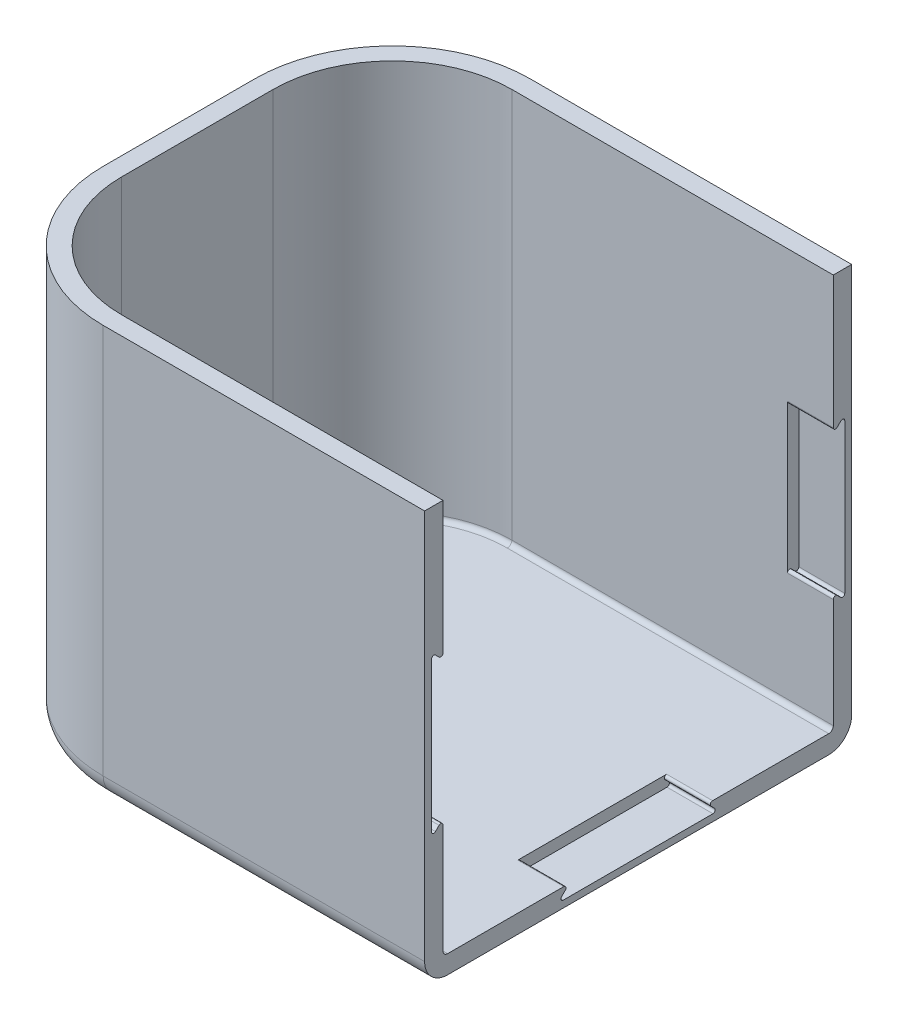
from build123d import *

# Parameters (mm, degrees)
SKETCH_1_W           = 100
SKETCH_1_H           = 93
EXTRUDE_1_DEPTH      = 90
FILLET_8_R           = 30
FILLET_9_R           = 5
SHELL_4_T            = -4
CUT_EXTRUDE_16_DEPTH = 10
FILLET_12_R          = 0.5


with BuildPart() as part:
    # 草圖1 → 填料-伸長1 (new body)
    with BuildSketch(Plane(origin=(0, 0, 0), x_dir=(1, 0, 0), z_dir=(0, 1, 0))):
        with Locations((-50, 0)):
            Rectangle(SKETCH_1_W, SKETCH_1_H)
    extrude(amount=EXTRUDE_1_DEPTH)

    # 圓角8
    fillet_8_edges = [part.edges().sort_by_distance(p)[0] for p in [
        (-100, 45, 46.5),
        (-100, 45, -46.5),
    ]]
    fillet(fillet_8_edges, radius=FILLET_8_R)

    # 圓角9
    fillet_9_edges = [part.edges().sort_by_distance(p)[0] for p in [
        (-100, 0, 0),
        (-35, 0, 46.5),
        (-91.213203436, 0, 37.713203436),
        (-91.213203436, 0, -37.713203436),
        (-35, 0, -46.5),
    ]]
    fillet(fillet_9_edges, radius=FILLET_9_R)

    # 薄殼4
    shell_4_openings = [part.faces().sort_by_distance(p)[0] for p in [
        (-48.123603577, 90, 0),
        (0, 45.056329123, 0),
    ]]
    offset(amount=SHELL_4_T, openings=shell_4_openings, kind=Kind.INTERSECTION)

    # 草圖21 → 除料-伸長16 (cut)
    with BuildSketch(Plane(origin=(0, 0, 0), x_dir=(0, 0, -1), z_dir=(1, 0, 0))):
        Polygon((-42.5, 60), (42.5, 60), (45, 62.5), (45, 27.5), (42.5, 30), (15, 30), (15, 4), (17.5, 1.5), (-17.5, 1.5), (-15, 4), (-15, 30), (-42.5, 30), (-45, 27.5), (-45, 62.5), align=None)
    extrude(amount=-CUT_EXTRUDE_16_DEPTH, mode=Mode.SUBTRACT)

    # 圓角12
    fillet_12_edges = [part.edges().sort_by_distance(p)[0] for p in [
        (-5, 60, -42.5),
        (-5, 62.5, -45),
        (-5, 27.5, -45),
        (-5, 30, -42.5),
        (-5, 4, -15),
        (-5, 1.5, -17.5),
        (-5, 1.5, 17.5),
        (-5, 4, 15),
        (-5, 30, 42.5),
        (-5, 27.5, 45),
        (-5, 62.5, 45),
        (-5, 60, 42.5),
    ]]
    fillet(fillet_12_edges, radius=FILLET_12_R)


solid = part.part
